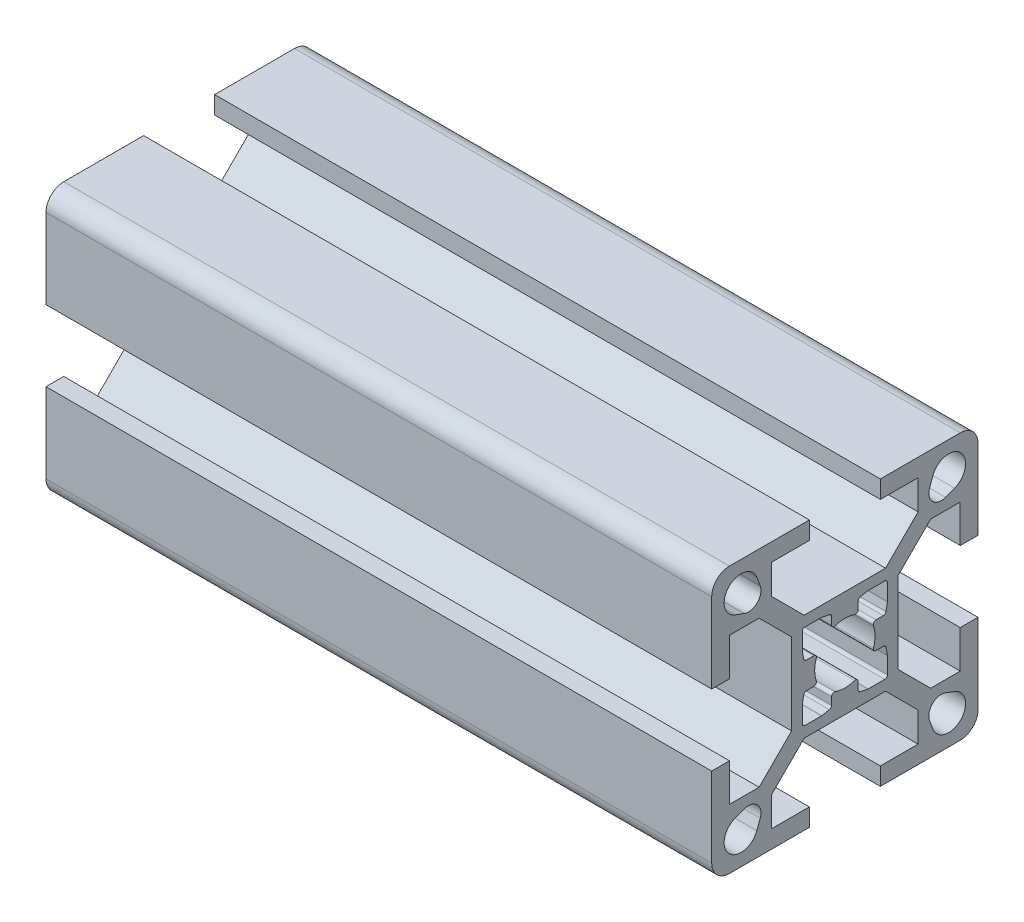
from build123d import *

# Parameters (mm, degrees)
BOSS_EXTRUDE1_DEPTH = 75


with BuildPart() as part:
    # Sketch1 → Boss-Extrude1 (new body)
    with BuildSketch(Plane(origin=(0, 0, 0), x_dir=(0, 0, -1), z_dir=(1, 0, 0))):
        with BuildLine():
            Line((-15, 13), (-15, 4))
            Line((-15, 4), (-13, 4))
            Line((-13, 4), (-13, 8.25))
            Line((-13, 8.25), (-9.664213562, 8.25))
            Line((-9.664213562, 8.25), (-6, 4.585786438))
            Line((-6, 4.585786438), (-6, -4.585786438))
            Line((-6, -4.585786438), (-9.664213562, -8.25))
            Line((-9.664213562, -8.25), (-13, -8.25))
            Line((-13, -8.25), (-13, -4))
            Line((-13, -4), (-15, -4))
            Line((-15, -4), (-15, -13))
            ThreePointArc((-15, -13), (-14.414213562, -14.414213562), (-13, -15))
            Line((-13, -15), (-4, -15))
            Line((-4, -15), (-4, -13))
            Line((-4, -13), (-8.25, -13))
            Line((-8.25, -13), (-8.25, -9.664213562))
            Line((-8.25, -9.664213562), (-4.585786438, -6))
            Line((-4.585786438, -6), (4.585786438, -6))
            Line((4.585786438, -6), (8.25, -9.664213562))
            Line((8.25, -9.664213562), (8.25, -13))
            Line((8.25, -13), (4, -13))
            Line((4, -13), (4, -15))
            Line((4, -15), (13, -15))
            ThreePointArc((13, -15), (14.414213562, -14.414213562), (15, -13))
            Line((15, -13), (15, -4))
            Line((15, -4), (13, -4))
            Line((13, -4), (13, -8.25))
            Line((13, -8.25), (9.664213562, -8.25))
            Line((9.664213562, -8.25), (6, -4.585786438))
            Line((6, -4.585786438), (6, 4.585786438))
            Line((6, 4.585786438), (9.664213562, 8.25))
            Line((9.664213562, 8.25), (13, 8.25))
            Line((13, 8.25), (13, 4))
            Line((13, 4), (15, 4))
            Line((15, 4), (15, 13))
            ThreePointArc((15, 13), (14.414213562, 14.414213562), (13, 15))
            Line((13, 15), (4, 15))
            Line((4, 15), (4, 13))
            Line((4, 13), (8.25, 13))
            Line((8.25, 13), (8.25, 9.664213562))
            Line((8.25, 9.664213562), (4.585786438, 6))
            Line((4.585786438, 6), (-4.585786438, 6))
            Line((-4.585786438, 6), (-8.25, 9.664213562))
            Line((-8.25, 9.664213562), (-8.25, 13))
            Line((-8.25, 13), (-4, 13))
            Line((-4, 13), (-4, 15))
            Line((-4, 15), (-13, 15))
            ThreePointArc((-13, 15), (-14.414213562, 14.414213562), (-15, 13))
        make_face()
        with BuildLine():
            Line((-9.539070071, 11.338915743), (-9.918883282, 12.361530981))
            ThreePointArc((-9.918883282, 12.361530981), (-13.043502884, 13.043502884), (-12.361530981, 9.918883282))
            Line((-12.361530981, 9.918883282), (-11.338915743, 9.539070071))
            ThreePointArc((-11.338915743, 9.539070071), (-9.861522369, 9.861522369), (-9.539070071, 11.338915743))
        make_face(mode=Mode.SUBTRACT)
        with BuildLine():
            Line((9.918883282, 12.361530981), (9.539070071, 11.338915743))
            ThreePointArc((9.539070071, 11.338915743), (9.861522369, 9.861522369), (11.338915743, 9.539070071))
            Line((11.338915743, 9.539070071), (12.361530981, 9.918883282))
            ThreePointArc((12.361530981, 9.918883282), (13.043502884, 13.043502884), (9.918883282, 12.361530981))
        make_face(mode=Mode.SUBTRACT)
        with BuildLine():
            Line((12.361530981, -9.918883282), (11.338915743, -9.539070071))
            ThreePointArc((11.338915743, -9.539070071), (9.861522369, -9.861522369), (9.539070071, -11.338915743))
            Line((9.539070071, -11.338915743), (9.918883282, -12.361530981))
            ThreePointArc((9.918883282, -12.361530981), (13.043502884, -13.043502884), (12.361530981, -9.918883282))
        make_face(mode=Mode.SUBTRACT)
        with BuildLine():
            Line((-11.338915743, -9.539070071), (-12.361530981, -9.918883282))
            ThreePointArc((-12.361530981, -9.918883282), (-13.043502884, -13.043502884), (-9.918883282, -12.361530981))
            Line((-9.918883282, -12.361530981), (-9.539070071, -11.338915743))
            ThreePointArc((-9.539070071, -11.338915743), (-9.861522369, -9.861522369), (-11.338915743, -9.539070071))
        make_face(mode=Mode.SUBTRACT)
        with BuildLine():
            Line((-4.8, -2.644433572), (-4.8, -4.5))
            ThreePointArc((-4.8, -4.5), (-4.712132034, -4.712132034), (-4.5, -4.8))
            Line((-4.5, -4.8), (-2.644433572, -4.8))
            ThreePointArc((-2.644433572, -4.8), (-2.615679847, -4.79861886), (-2.587190874, -4.794488155))
            Line((-2.587190874, -4.794488155), (-1.742757301, -4.630346896))
            ThreePointArc((-1.742757301, -4.630346896), (-1.568512625, -4.526682207), (-1.5, -4.335858741))
            Line((-1.5, -4.335858741), (-1.5, -3.5))
            ThreePointArc((-1.5, -3.5), (-1.374371458, -3.255879959), (-1.102702703, -3.216216216))
            ThreePointArc((-1.102702703, -3.216216216), (0, -3.4), (1.102702703, -3.216216216))
            ThreePointArc((1.102702703, -3.216216216), (1.374371458, -3.255879959), (1.5, -3.5))
            Line((1.5, -3.5), (1.5, -4.335858741))
            ThreePointArc((1.5, -4.335858741), (1.568512625, -4.526682207), (1.742757301, -4.630346896))
            Line((1.742757301, -4.630346896), (2.587190874, -4.794488155))
            ThreePointArc((2.587190874, -4.794488155), (2.615679847, -4.79861886), (2.644433572, -4.8))
            Line((2.644433572, -4.8), (4.5, -4.8))
            ThreePointArc((4.5, -4.8), (4.712132034, -4.712132034), (4.8, -4.5))
            Line((4.8, -4.5), (4.8, -2.644433572))
            ThreePointArc((4.8, -2.644433572), (4.79861886, -2.615679847), (4.794488155, -2.587190874))
            Line((4.794488155, -2.587190874), (4.630346896, -1.742757301))
            ThreePointArc((4.630346896, -1.742757301), (4.526682207, -1.568512625), (4.335858741, -1.5))
            Line((4.335858741, -1.5), (3.5, -1.5))
            ThreePointArc((3.5, -1.5), (3.255879959, -1.374371458), (3.216216216, -1.102702703))
            ThreePointArc((3.216216216, -1.102702703), (3.4, 0), (3.216216216, 1.102702703))
            ThreePointArc((3.216216216, 1.102702703), (3.255879959, 1.374371458), (3.5, 1.5))
            Line((3.5, 1.5), (4.335858741, 1.5))
            ThreePointArc((4.335858741, 1.5), (4.526682207, 1.568512625), (4.630346896, 1.742757301))
            Line((4.630346896, 1.742757301), (4.794488155, 2.587190874))
            ThreePointArc((4.794488155, 2.587190874), (4.79861886, 2.615679847), (4.8, 2.644433572))
            Line((4.8, 2.644433572), (4.8, 4.5))
            ThreePointArc((4.8, 4.5), (4.712132034, 4.712132034), (4.5, 4.8))
            Line((4.5, 4.8), (2.644433572, 4.8))
            ThreePointArc((2.644433572, 4.8), (2.615679847, 4.79861886), (2.587190874, 4.794488155))
            Line((2.587190874, 4.794488155), (1.742757301, 4.630346896))
            ThreePointArc((1.742757301, 4.630346896), (1.568512625, 4.526682207), (1.5, 4.335858741))
            Line((1.5, 4.335858741), (1.5, 3.5))
            ThreePointArc((1.5, 3.5), (1.374371458, 3.255879959), (1.102702703, 3.216216216))
            ThreePointArc((1.102702703, 3.216216216), (0, 3.4), (-1.102702703, 3.216216216))
            ThreePointArc((-1.102702703, 3.216216216), (-1.374371458, 3.255879959), (-1.5, 3.5))
            Line((-1.5, 3.5), (-1.5, 4.335858741))
            ThreePointArc((-1.5, 4.335858741), (-1.568512625, 4.526682207), (-1.742757301, 4.630346896))
            Line((-1.742757301, 4.630346896), (-2.587190874, 4.794488155))
            ThreePointArc((-2.587190874, 4.794488155), (-2.615679847, 4.79861886), (-2.644433572, 4.8))
            Line((-2.644433572, 4.8), (-4.5, 4.8))
            ThreePointArc((-4.5, 4.8), (-4.712132034, 4.712132034), (-4.8, 4.5))
            Line((-4.8, 4.5), (-4.8, 2.644433572))
            ThreePointArc((-4.8, 2.644433572), (-4.79861886, 2.615679847), (-4.794488155, 2.587190874))
            Line((-4.794488155, 2.587190874), (-4.630346896, 1.742757301))
            ThreePointArc((-4.630346896, 1.742757301), (-4.526682207, 1.568512625), (-4.335858741, 1.5))
            Line((-4.335858741, 1.5), (-3.5, 1.5))
            ThreePointArc((-3.5, 1.5), (-3.255879959, 1.374371458), (-3.216216216, 1.102702703))
            ThreePointArc((-3.216216216, 1.102702703), (-3.4, 0), (-3.216216216, -1.102702703))
            ThreePointArc((-3.216216216, -1.102702703), (-3.255879959, -1.374371458), (-3.5, -1.5))
            Line((-3.5, -1.5), (-4.335858741, -1.5))
            ThreePointArc((-4.335858741, -1.5), (-4.526682207, -1.568512625), (-4.630346896, -1.742757301))
            Line((-4.630346896, -1.742757301), (-4.794488155, -2.587190874))
            ThreePointArc((-4.794488155, -2.587190874), (-4.79861886, -2.615679847), (-4.8, -2.644433572))
        make_face(mode=Mode.SUBTRACT)
    extrude(amount=BOSS_EXTRUDE1_DEPTH)


solid = part.part
